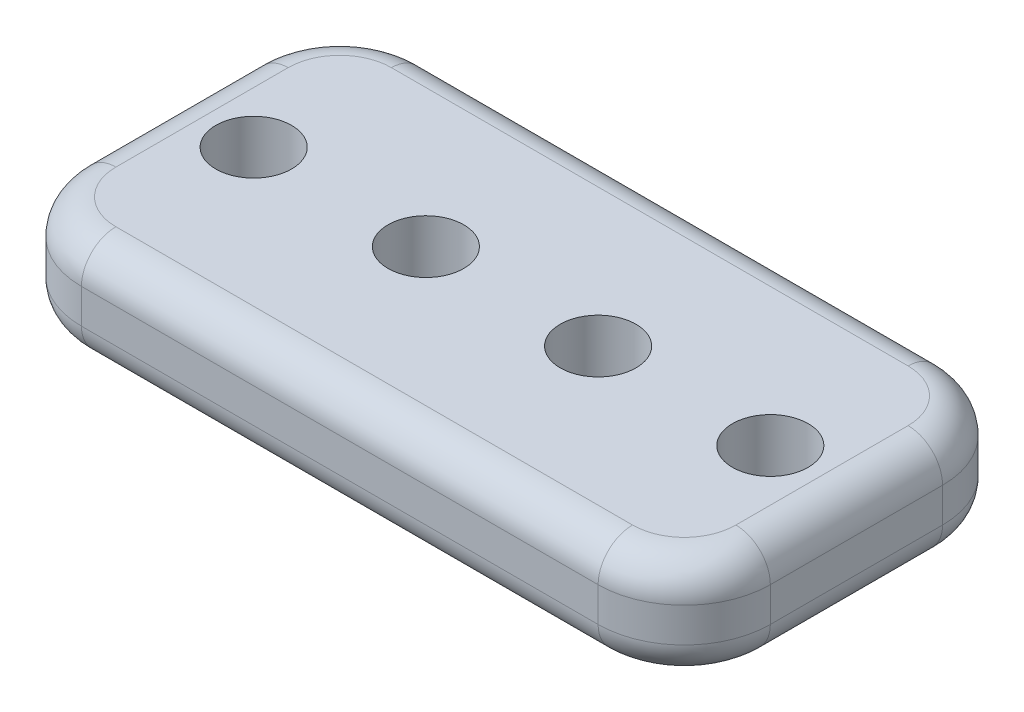
from build123d import *

# Parameters (mm, degrees)
EXTRUDE_1_DEPTH            = 3
F_2_2_2_2_DIAMETER_HOLE1_D = 2.2
FILLET_1_R                 = 1


with BuildPart() as part:
    # 草图1 → 凸台-拉伸1 (new body)
    with BuildSketch(Plane(origin=(0, 0, 0), x_dir=(1, 0, 0), z_dir=(0, 1, 0))):
        with BuildLine():
            Line((-7.5, 5), (7.5, 5))
            ThreePointArc((7.5, 5), (9.267766953, 4.267766953), (10, 2.5))
            Line((10, 2.5), (10, -2.5))
            ThreePointArc((10, -2.5), (9.267766953, -4.267766953), (7.5, -5))
            Line((7.5, -5), (-7.5, -5))
            ThreePointArc((-7.5, -5), (-9.267766953, -4.267766953), (-10, -2.5))
            Line((-10, -2.5), (-10, 2.5))
            ThreePointArc((-10, 2.5), (-9.267766953, 4.267766953), (-7.5, 5))
        make_face()
    extrude(amount=EXTRUDE_1_DEPTH)

    # Ø2.2 (2.2) Diameter Hole1 (through all)
    with Locations(Plane(origin=(0, 3, 0), x_dir=(1, 0, 0), z_dir=(0, 1, 0))):
        with Locations((-7.5, 0), (-2.5, 0)):
            f_2_2_2_2_diameter_hole1 = Hole(F_2_2_2_2_DIAMETER_HOLE1_D / 2)

    # 镜向1: Ø2.2 (2.2) Diameter Hole1 across plane
    add(f_2_2_2_2_diameter_hole1.mirror(Plane(origin=(0, 0, 0), x_dir=(0, 0, 1), z_dir=(1, 0, 0))), mode=Mode.SUBTRACT)

    # 圆角1
    fillet_1_edges = [part.edges().sort_by_distance(p)[0] for p in [
        (0, 0, -5),
        (9.267766953, 0, -4.267766953),
        (10, 0, 0),
        (9.267766953, 0, 4.267766953),
        (9.267766953, 3, -4.267766953),
        (0, 3, -5),
        (-9.267766953, 3, -4.267766953),
        (-10, 3, 0),
        (-9.267766953, 3, 4.267766953),
        (0, 3, 5),
        (9.267766953, 3, 4.267766953),
        (0, 0, 5),
        (10, 3, 0),
        (-9.267766953, 0, 4.267766953),
        (-10, 0, 0),
        (-9.267766953, 0, -4.267766953),
    ]]
    fillet(fillet_1_edges, radius=FILLET_1_R)


solid = part.part
